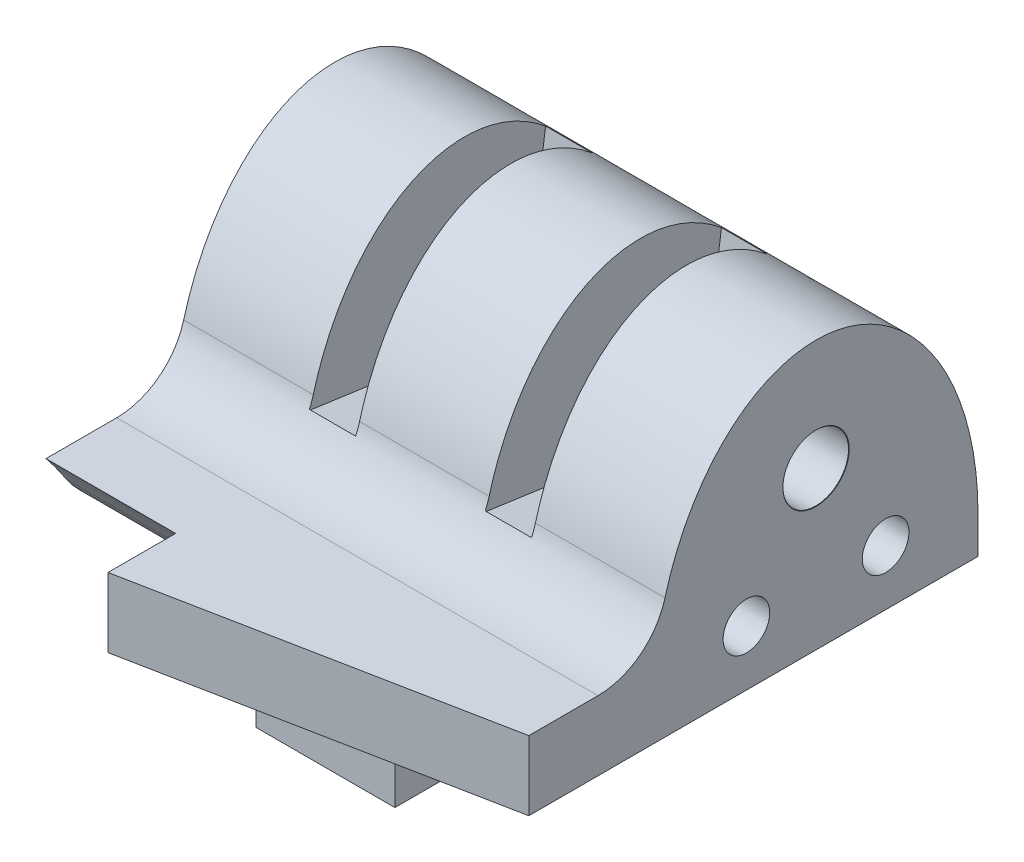
from build123d import *

# Parameters (mm, degrees)
BOSS_EXTRUDE1_DEPTH            = 33.02
M4_CLEARANCE_HOLE1_D           = 4.5
M4_CLEARANCE_HOLE1_CSINK_D     = 4.55
M4_CLEARANCE_HOLE1_CSINK_ANGLE = 100
SKETCH5_W                      = 9.525
SKETCH5_H                      = 25.4
BOSS_EXTRUDE2_DEPTH            = 9.525
F_8_CLEARANCE_HOLE1_D          = 4.4958
CUT_EXTRUDE1_DEPTH             = 51.586230043
CUT_EXTRUDE1_DEPTH_BACK        = 51.586230043
CUT_EXTRUDE3_DEPTH             = 3.175
LPATTERN1_COUNT                = 2
LPATTERN1_PITCH                = 12.065
CUT_EXTRUDE4_DEPTH             = 2.413
SKETCH13_R                     = 1.599999975
CUT_EXTRUDE5_DEPTH             = 9.525
CUT_EXTRUDE6_DEPTH             = 8.89
CUT_EXTRUDE6_DEPTH_BACK        = 51.586230043


with BuildPart() as part:
    # Sketch1 → Boss-Extrude1 (new body)
    with BuildSketch(Plane.YZ):
        with BuildLine():
            Line((0, 0), (0, 35.56))
            Line((0, 35.56), (4.7625, 35.56))
            Line((4.7625, 35.56), (4.7625, 26.070051643))
            ThreePointArc((4.7625, 26.070051643), (5.742064598, 23.176817123), (8.277799105, 21.473760076))
            add(Edge.make_bspline(
                [(2.54, 0), (15.72103374, 0), (18.14439364, 9.069444242), (20.567753539, 18.138888484), (8.277799105, 21.473760076)],
                knots=[1.570796327, 1.570796327, 1.570796327, 2.95668879, 2.95668879, 4.342581253, 4.342581253, 4.342581253], degree=2, weights=[1, 0.769367284, 1, 0.769367284, 1]))
            Line((2.54, 0), (0, 0))
        make_face()
    extrude(amount=BOSS_EXTRUDE1_DEPTH)

    # M4 Clearance Hole1 (through all)
    with Locations(Plane(origin=(33.02, 0, 0), x_dir=(0, 0, -1), z_dir=(1, 0, 0))):
        with Locations((-11.1125, 10.795)):
            CounterSinkHole(M4_CLEARANCE_HOLE1_D / 2, M4_CLEARANCE_HOLE1_CSINK_D / 2, counter_sink_angle=M4_CLEARANCE_HOLE1_CSINK_ANGLE)

    # Sketch5 → Boss-Extrude2 (add)
    with BuildSketch(Plane(origin=(8.89, 0, 0), x_dir=(0, -1, 0), z_dir=(-1, 0, 0))):
        with Locations((4.7625, 12.7)):
            Rectangle(SKETCH5_W, SKETCH5_H)
    extrude(amount=-BOSS_EXTRUDE2_DEPTH)

    # #8 Clearance Hole1 (through all)
    with Locations(Plane.ZY):
        with Locations((6.35, -4.7625), (19.05, -4.7625)):
            Hole(F_8_CLEARANCE_HOLE1_D / 2)

    # Sketch8 → Cut-Extrude1 (cut, two sides: drawn at the far end of the back side and taken through both)
    with BuildSketch(Plane(origin=(0, 4.7625, 0), x_dir=(-1, 0, 0), z_dir=(0, 1, 0)).offset(-CUT_EXTRUDE1_DEPTH_BACK)):
        Polygon((-33.02, 35.56), (-8.89, 35.56), (-33.02, 30.815025822), align=None)
    extrude(amount=CUT_EXTRUDE1_DEPTH + CUT_EXTRUDE1_DEPTH_BACK, mode=Mode.SUBTRACT)

    # Sketch9 → Cut-Extrude3 (cut)
    with BuildSketch(Plane.YZ.offset(8.89)):
        with BuildLine():
            Line((7.470230181, 21.675508242), (5.416036429, 7.059160216))
            Line((5.416036429, 7.059160216), (16.269581823, 5.533793887))
            ThreePointArc((16.269581823, 5.533793887), (22.282600027, 19.280935147), (7.470230181, 21.675508242))
        make_face()
    cut_extrude3 = extrude(amount=CUT_EXTRUDE3_DEPTH, mode=Mode.SUBTRACT)

    # LPattern1: Cut-Extrude3 ×2
    with Locations(*[(i * LPATTERN1_PITCH, 0, 0) for i in range(1, LPATTERN1_COUNT)]):
        add(cut_extrude3, mode=Mode.SUBTRACT)

    # Sketch12 → Cut-Extrude4 (cut)
    with BuildSketch(Plane(origin=(27.94, 0, 0), x_dir=(0, 0, -1), z_dir=(1, 0, 0))):
        Polygon((-18.6309, 2.226212742), (-18.6309, 0), (-13.1445, 0), (-13.1445, 2.226212742), (-15.8877, 0.642425483), align=None)
        Polygon((-18.6309, 5.393787258), (-18.6309, 3.81), (-13.1445, 3.81), (-13.1445, 5.393787258), (-15.8877, 6.977574517), align=None)
        Polygon((-9.0805, 3.81), (-3.5941, 3.81), (-3.5941, 5.393787258), (-6.3373, 6.977574517), (-9.0805, 5.393787258), align=None)
        Polygon((-6.3373, 0.642425483), (-3.5941, 2.226212742), (-3.5941, 3.81), (-9.0805, 3.81), (-9.0805, 2.226212742), align=None)
        Polygon((-9.0805, 0), (-3.5941, 0), (-3.5941, 2.226212742), (-6.3373, 0.642425483), (-9.0805, 2.226212742), align=None)
        Polygon((-18.6309, 3.81), (-18.6309, 2.226212742), (-15.8877, 0.642425483), (-13.1445, 2.226212742), (-13.1445, 3.81), align=None)
    extrude(amount=-CUT_EXTRUDE4_DEPTH, mode=Mode.SUBTRACT)

    # Sketch13 → Cut-Extrude5 (cut)
    with BuildSketch(Plane.YZ.offset(33.02)):
        with Locations(Location((3.81, 15.8877, 0), (0, 0, 270))):
            Circle(SKETCH13_R)
        with Locations(Location((3.81, 6.3373, 0), (0, 0, 270))):
            Circle(SKETCH13_R)
    extrude(amount=-CUT_EXTRUDE5_DEPTH, mode=Mode.SUBTRACT)

    # Sketch15 → Cut-Extrude6 (cut, two sides: drawn at the far end of the back side and taken through both)
    with BuildSketch(Plane(origin=(0, 4.7625, 0), x_dir=(0, 1, 0), z_dir=(1, 0, 0)).offset(-CUT_EXTRUDE6_DEPTH_BACK)):
        with BuildLine():
            Line((-14.2875, 27.94), (-4.7625, 27.94))
            Line((-4.7625, 27.94), (-4.7625, 35.56))
            Line((-4.7625, 35.56), (0, 35.56))
            Line((0, 35.56), (0, 30.919456431))
            ThreePointArc((0, 30.919456431), (6.552801948, 39.188062352), (8.89, 49.47623821))
            ThreePointArc((8.89, 49.47623821), (-31.98350955, 66.08819503), (-14.2875, 25.672206383))
            Line((-14.2875, 25.672206383), (-14.2875, 27.94))
        make_face()
        with BuildLine():
            Line((-4.7625, 35.56), (-4.7625, 27.94))
            ThreePointArc((-4.7625, 27.94), (-3.297566963, 28.694128401), (-1.888289474, 29.547753265))
            ThreePointArc((-1.888289474, 29.547753265), (-0.927329109, 30.21045642), (0, 30.919456431))
            Line((0, 30.919456431), (0, 35.56))
            Line((0, 35.56), (-4.7625, 35.56))
        make_face()
        with BuildLine():
            Line((-4.7625, 27.94), (-4.7625, 24.233490613))
            ThreePointArc((-4.7625, 24.233490613), (-3.997916867, 27.254354467), (-1.888289474, 29.547753265))
            ThreePointArc((-1.888289474, 29.547753265), (-3.297566963, 28.694128401), (-4.7625, 27.94))
        make_face()
        with BuildLine():
            Line((-14.2875, 0), (-4.7625, 0))
            Line((-4.7625, 0), (-4.7625, 24.233490613))
            Line((-4.7625, 24.233490613), (-4.7625, 27.94))
            ThreePointArc((-4.7625, 27.94), (-9.407182401, 26.311255412), (-14.2875, 25.672206383))
            Line((-14.2875, 25.672206383), (-14.2875, 0))
        make_face()
        with BuildLine():
            ThreePointArc((-14.2875, 25.672206383), (-9.407182401, 26.311255412), (-4.7625, 27.94))
            Line((-4.7625, 27.94), (-14.2875, 27.94))
            Line((-14.2875, 27.94), (-14.2875, 25.672206383))
        make_face()
    extrude(amount=CUT_EXTRUDE6_DEPTH + CUT_EXTRUDE6_DEPTH_BACK, mode=Mode.SUBTRACT)


solid = part.part
